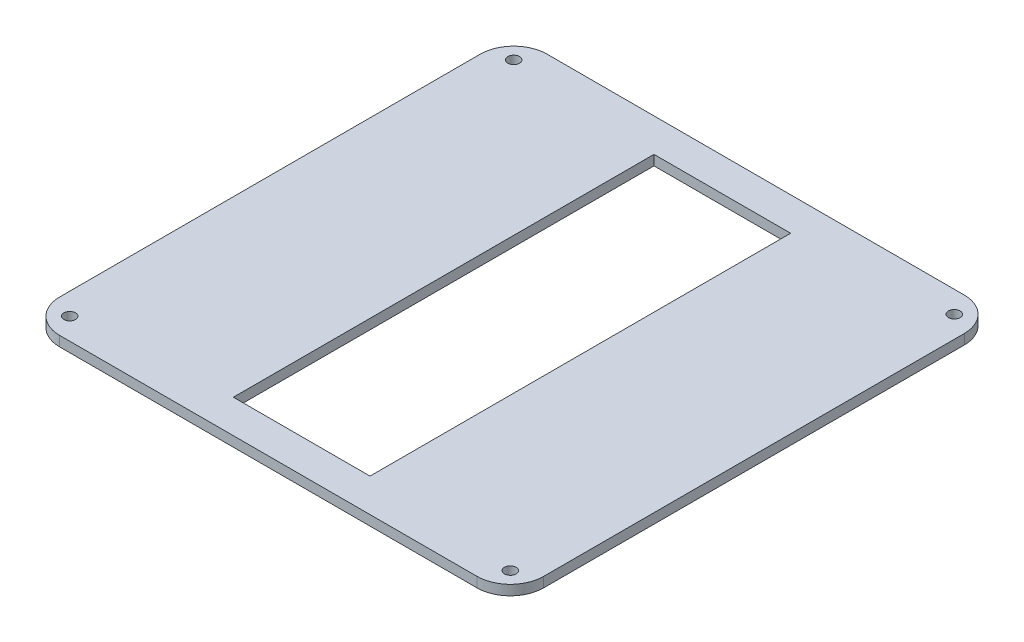
from build123d import *

# Parameters (mm, degrees)
ESQUISSE1_R        = 1.75
ESQUISSE1_W        = 41
ESQUISSE1_H        = 126.2
BOSS_EXTRU_1_DEPTH = 3


with BuildPart() as part:
    # Esquisse1 → Boss.-Extru.1 (new body)
    with BuildSketch(Plane(origin=(0, 0, 0), x_dir=(1, 0, 0), z_dir=(0, 1, 0))):
        with BuildLine():
            Line((-72.6, -63.1), (-72.6, 63.1))
            ThreePointArc((-72.6, 63.1), (-69.671067812, 70.171067812), (-62.6, 73.1))
            Line((-62.6, 73.1), (62.6, 73.1))
            ThreePointArc((62.6, 73.1), (69.671067812, 70.171067812), (72.6, 63.1))
            Line((72.6, 63.1), (72.6, -63.1))
            ThreePointArc((72.6, -63.1), (69.671067812, -70.171067812), (62.6, -73.1))
            Line((62.6, -73.1), (-62.6, -73.1))
            ThreePointArc((-62.6, -73.1), (-69.671067812, -70.171067812), (-72.6, -63.1))
        make_face()
        with Locations(Location((-66.1, 66.6, 0), (0, 0, 270))):
            Circle(ESQUISSE1_R, mode=Mode.SUBTRACT)
        with Locations(Location((66.1, 66.6, 0), (0, 0, 270))):
            Circle(ESQUISSE1_R, mode=Mode.SUBTRACT)
        with Locations(Location((66.1, -66.6, 0), (0, 0, 270))):
            Circle(ESQUISSE1_R, mode=Mode.SUBTRACT)
        with Locations(Location((-66.1, -66.6, 0), (0, 0, 270))):
            Circle(ESQUISSE1_R, mode=Mode.SUBTRACT)
        Rectangle(ESQUISSE1_W, ESQUISSE1_H, mode=Mode.SUBTRACT)
    extrude(amount=BOSS_EXTRU_1_DEPTH)


solid = part.part
